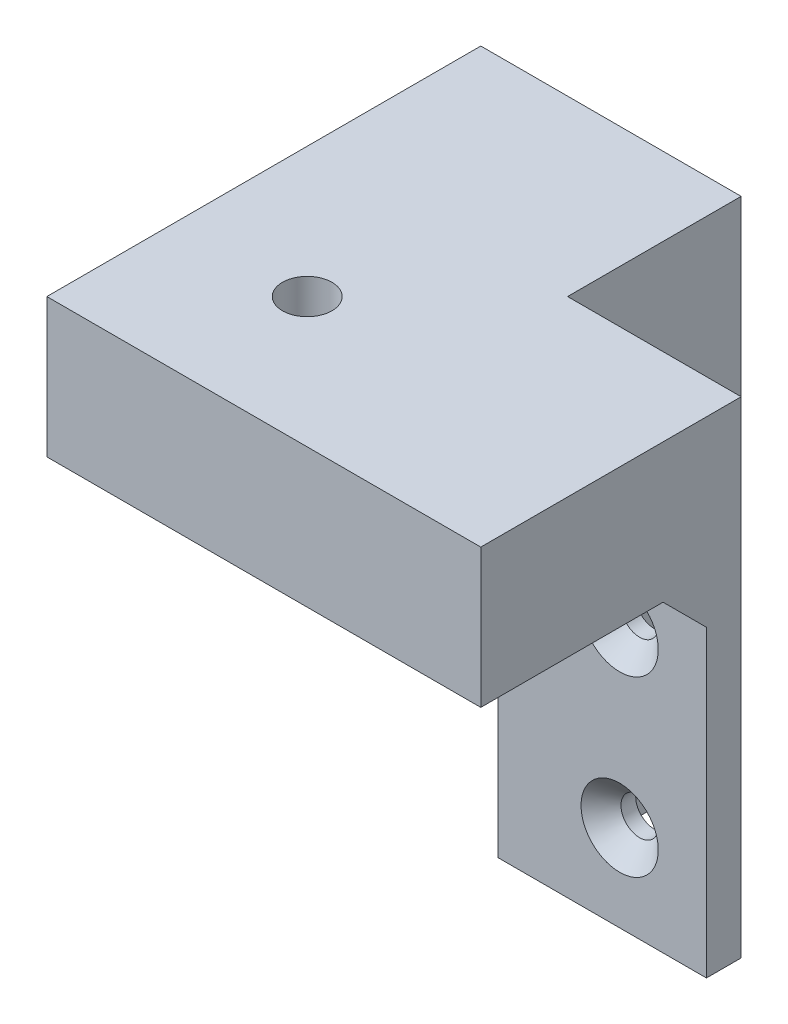
from build123d import *

# Parameters (mm, degrees)
BOSS_EXTRUDE1_DEPTH = 30
BOSS_EXTRUDE2_DEPTH = 30
SKETCH3_R           = 2.85
CUT_EXTRUDE1_DEPTH  = 67
SKETCH4_R           = 2.85
CUT_EXTRUDE2_DEPTH  = 67.627240093
SKETCH5_R           = 2.85
CUT_EXTRUDE3_DEPTH  = 67.462848717
BOSS_EXTRUDE3_DEPTH = 40
SKETCH7_R           = 2.15
CUT_EXTRUDE4_DEPTH  = 86.064681273
SKETCH8_R           = 2.15
CUT_EXTRUDE5_DEPTH  = 91.19977827
CHAMFER1_SIZE       = 2.3
CHAMFER2_SIZE       = 5
SKETCH9_W           = 30
SKETCH9_H           = 30
CUT_EXTRUDE6_DEPTH  = 76.498344353


with BuildPart() as part:
    # Sketch1 → Boss-Extrude1 (new body)
    with BuildSketch(Plane.XY):
        Polygon((10, 0), (40, -5.357142857), (38.099489796, -16), (-40, -16), (-40, 0), align=None)
    extrude(amount=BOSS_EXTRUDE1_DEPTH)

    # Sketch2 → Boss-Extrude2 (add)
    with BuildSketch(Plane.ZY.offset(40)):
        Polygon((0, 0), (-20, 0), (-50, -5.357142857), (-48.099489796, -16), (0, -16), align=None)
    extrude(amount=-BOSS_EXTRUDE2_DEPTH)

    # Sketch3 → Cut-Extrude1 (cut, through all)
    with BuildSketch(Plane(origin=(0, 0, 0), x_dir=(1, 0, 0), z_dir=(0, 1, 0))):
        with Locations(Location((-25, -15, 0), (0, 0, 180))):
            Circle(SKETCH3_R)
    extrude(amount=-CUT_EXTRUDE1_DEPTH, mode=Mode.SUBTRACT)

    # Sketch4 → Cut-Extrude2 (cut, through all)
    with BuildSketch(Plane(origin=(0.309023486, 1.73053152, 0), x_dir=(0.9844275755084806, -0.17579063848366547, 0), z_dir=(0.17579063848366547, 0.9844275755084806, 0))):
        with Locations(Location((25.081557169, -15, 0), (0, 0, 180))):
            Circle(SKETCH4_R)
    extrude(amount=-CUT_EXTRUDE2_DEPTH, mode=Mode.SUBTRACT)

    # Sketch5 → Cut-Extrude3 (cut, through all)
    with BuildSketch(Plane(origin=(0, 3.461063041, -0.618046972), x_dir=(1, 0, 0), z_dir=(0, 0.9844275755084821, -0.1757906384836575))):
        with Locations(Location((-25, 34.925832924, 0), (0, 0, 270))):
            Circle(SKETCH5_R)
    extrude(amount=-CUT_EXTRUDE3_DEPTH, mode=Mode.SUBTRACT)

    # Sketch6 → Boss-Extrude3 (add)
    with BuildSketch(Plane.XZ.offset(16)):
        Polygon((-10, 0), (-10, -20), (-14, -20), (-14, 4), (10, 4), (10, 0), align=None)
    extrude(amount=BOSS_EXTRUDE3_DEPTH)

    # Sketch7 → Cut-Extrude4 (cut, through all)
    with BuildSketch(Plane(origin=(0, 0, 0), x_dir=(-1, 0, 0), z_dir=(0, 0, -1))):
        with Locations((0, -46)):
            Circle(SKETCH7_R)
        with Locations((0, -26)):
            Circle(SKETCH7_R)
    extrude(amount=-CUT_EXTRUDE4_DEPTH, mode=Mode.SUBTRACT)

    # Sketch8 → Cut-Extrude5 (cut, through all)
    with BuildSketch(Plane(origin=(-10, 0, 0), x_dir=(0, 0, -1), z_dir=(1, 0, 0))):
        with Locations((10, -46)):
            Circle(SKETCH8_R)
        with Locations((10, -26)):
            Circle(SKETCH8_R)
    extrude(amount=-CUT_EXTRUDE5_DEPTH, mode=Mode.SUBTRACT)

    # Chamfer1
    chamfer1_edges = [part.edges().sort_by_distance(p)[0] for p in [
        (2.15, -46, 4),
        (2.15, -26, 4),
        (-14, -46, -7.85),
        (-14, -26, -7.85),
    ]]
    chamfer(chamfer1_edges, length=CHAMFER1_SIZE)

    # Chamfer2
    chamfer2_edges = [part.edges().sort_by_distance(p)[0] for p in [
        (-2, -16, 4),
        (-14, -16, -8),
    ]]
    chamfer(chamfer2_edges, length=CHAMFER2_SIZE)

    # Sketch9 → Cut-Extrude6 (cut, through all)
    with BuildSketch(Plane.XZ.offset(16)):
        with Locations((25, 15)):
            Rectangle(SKETCH9_W, SKETCH9_H)
        with Locations((-25, -35)):
            Rectangle(SKETCH9_W, SKETCH9_H)
    extrude(amount=-CUT_EXTRUDE6_DEPTH, mode=Mode.SUBTRACT)


solid = part.part
